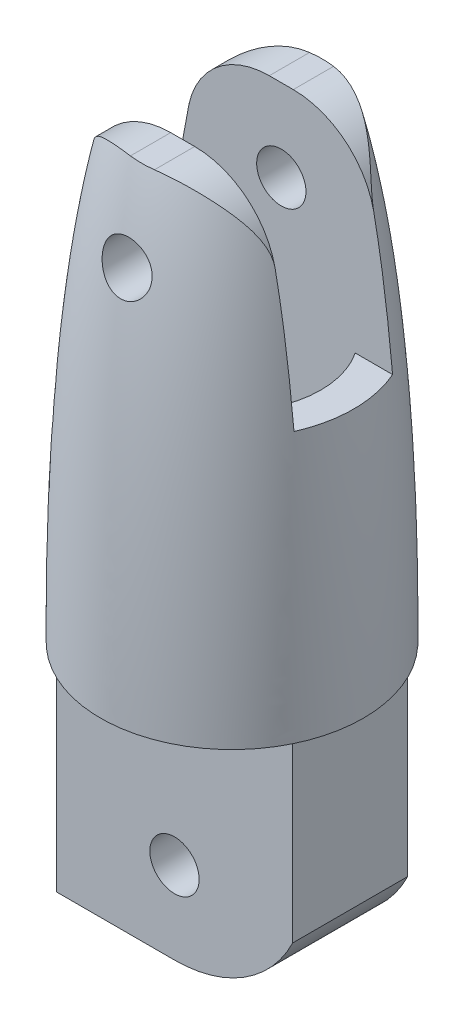
from build123d import *

# Parameters (mm, degrees)
CUT_EXTRUDE1_DEPTH      = 31.199528082
CUT_EXTRUDE1_DEPTH_BACK = 31.199528082
SKETCH2_W               = 6
SKETCH2_H               = 12
BOSS_EXTRUDE1_DEPTH     = 3.5
CUT_EXTRUDE4_DEPTH      = 45.463597463
CUT_EXTRUDE4_DEPTH_BACK = 15
SKETCH4_W               = 0.806252715
SKETCH4_H               = 7
CUT_EXTRUDE5_DEPTH      = 14
CUT_EXTRUDE5_DEPTH_BACK = 14
SKETCH5_R               = 1.5
CUT_EXTRUDE6_DEPTH      = 12
CUT_EXTRUDE7_START      = 10
CUT_EXTRUDE7_DEPTH      = 18
SKETCH8_R               = 1
CUT_EXTRUDE8_DEPTH      = 45.463597463
SKETCH9_R               = 1


with BuildPart() as part:
    # Sketch1 → Revolve1 (revolve)
    with BuildSketch(Plane(origin=(0, 0, 0), x_dir=(0, 0, -1), z_dir=(1, 0, 0))):
        with BuildLine():
            Line((0, 0), (0, 28))
            Line((0, 28), (5.5, 28))
            add(Edge.make_bspline(
                [(5.5, 28), (8.088190451, 18.340741737), (8, 3.333333333), (8, 0)],
                knots=[0, 0, 0, 0, 1, 1, 1, 1], degree=3))
            Line((8, 0), (0, 0))
        make_face()
    revolve(axis=Axis((0, 0, 0), (0, 1, 0)))

    # Sketch2 → Cut-Extrude1 (cut, two sides: drawn at the far end of the back side and taken through both)
    with BuildSketch(Plane(origin=(0, 0, 0), x_dir=(0, 0, -1), z_dir=(1, 0, 0)).offset(-CUT_EXTRUDE1_DEPTH_BACK)):
        with Locations((0, 22)):
            Rectangle(SKETCH2_W, SKETCH2_H)
    extrude(amount=CUT_EXTRUDE1_DEPTH + CUT_EXTRUDE1_DEPTH_BACK, mode=Mode.SUBTRACT)

    # Sketch3 → Boss-Extrude1 (add, symmetric)
    with BuildSketch(Plane.XY):
        with BuildLine():
            Line((-8, 0), (-8, -15))
            Line((-8, -15), (0, -15))
            ThreePointArc((0, -15), (5.656854249, -12.656854249), (8, -7))
            Line((8, -7), (8, 0))
            Line((8, 0), (-8, 0))
        make_face()
    extrude(amount=BOSS_EXTRUDE1_DEPTH, both=True)

    # Sketch4 → Cut-Extrude4 (cut, two sides: drawn at the far end of the back side and taken through both)
    with BuildSketch(Plane.XZ.offset(15).offset(-CUT_EXTRUDE4_DEPTH_BACK)):
        with Locations((-7.596873643, 0)):
            Rectangle(SKETCH4_W, SKETCH4_H)
        with Locations((7.596873643, 0)):
            Rectangle(SKETCH4_W, SKETCH4_H)
    extrude(amount=CUT_EXTRUDE4_DEPTH + CUT_EXTRUDE4_DEPTH_BACK, mode=Mode.SUBTRACT)

    # Sketch5 → Cut-Extrude5 (cut, two sides: drawn at the far end of the back side and taken through both)
    with BuildSketch(Plane.XY.offset(-CUT_EXTRUDE5_DEPTH_BACK)):
        with Locations(Location((0, 23, 0), (0, 0, 270))):
            Circle(SKETCH5_R)
        with Locations((0, -10)):
            Circle(SKETCH5_R)
    extrude(amount=CUT_EXTRUDE5_DEPTH + CUT_EXTRUDE5_DEPTH_BACK, mode=Mode.SUBTRACT)

    # Sketch6 → Cut-Extrude6 (cut)
    with BuildSketch(Plane(origin=(0, 16, 0), x_dir=(1, 0, 0), z_dir=(0, 1, 0))):
        with BuildLine():
            ThreePointArc((-4.500600684, 3), (-5.408826723, 0), (-4.500600684, -3))
            Line((-4.500600684, -3), (4.500600684, -3))
            ThreePointArc((4.500600684, -3), (5.176793204, -1.567232795), (5.408826723, 0))
            ThreePointArc((5.408826723, 0), (5.176793204, 1.567232795), (4.500600684, 3))
            Line((4.500600684, 3), (-4.500600684, 3))
        make_face()
    extrude(amount=-CUT_EXTRUDE6_DEPTH, mode=Mode.SUBTRACT)

    # Sketch7 → Cut-Extrude7 (cut)
    with BuildSketch(Plane.XY.offset(CUT_EXTRUDE7_START)):
        with BuildLine():
            add(Edge.make_bspline(
                [(4.609772229, 28), (4.921871239, 27.023759734), (5.179569274, 26.037706908), (5.483962232, 24.698137834), (5.558895001, 24.349714977), (5.630197487, 24.00063731)],
                knots=[0, 0, 0, 0, 0.25, 0.25, 0.337633548, 0.337633548, 0.337633548, 0.337633548], degree=3))
            Line((4.609772229, 28), (0.731348135, 28))
            ThreePointArc((0.731348135, 28), (3.893373866, 26.873189032), (5.630197487, 24.00063731))
        make_face()
        with BuildLine():
            ThreePointArc((-5.630197487, 24.00063731), (-3.893373866, 26.873189032), (-0.731348135, 28))
            Line((-0.731348135, 28), (-4.609772229, 28))
            add(Edge.make_bspline(
                [(-5.630197487, 24.00063731), (-5.558895001, 24.349714977), (-5.483962232, 24.698137834), (-5.179569274, 26.037706908), (-4.921871239, 27.023759734), (-4.609772229, 28)],
                knots=[0.662366452, 0.662366452, 0.662366452, 0.662366452, 0.75, 0.75, 1, 1, 1, 1], degree=3))
        make_face()
    extrude(amount=-CUT_EXTRUDE7_DEPTH, mode=Mode.SUBTRACT)

    # Sketch8 → Cut-Extrude8 (cut, through all)
    with BuildSketch(Plane.XZ.offset(15)):
        with Locations(Location((3, 0, 0), (0, 0, 270))):
            Circle(SKETCH8_R)
    extrude(amount=-CUT_EXTRUDE8_DEPTH, mode=Mode.SUBTRACT)

    # Cut-Sweep1: sweep along a path in Sketch10
    with BuildLine() as cut_sweep1_path:  # in the path sketch's own coordinates; laid on its plane below (add() does not lay a ready-made edge on the line's plane)
        add(Edge.make_bspline(
            [(-7.193747285, -7.5), (-2.693747285, -7.5), (-2.693747285, 4)],
            knots=[0, 0, 0, 1, 1, 1], degree=2))
    # Sketch9 → Cut-Sweep1 (sweep, cut)
    with BuildSketch(Plane.ZY.offset(7.193747285)):
        with Locations((0, -7.5)):
            Circle(SKETCH9_R)
    sweep(path=Plane.XY * cut_sweep1_path.line, mode=Mode.SUBTRACT)


solid = part.part
